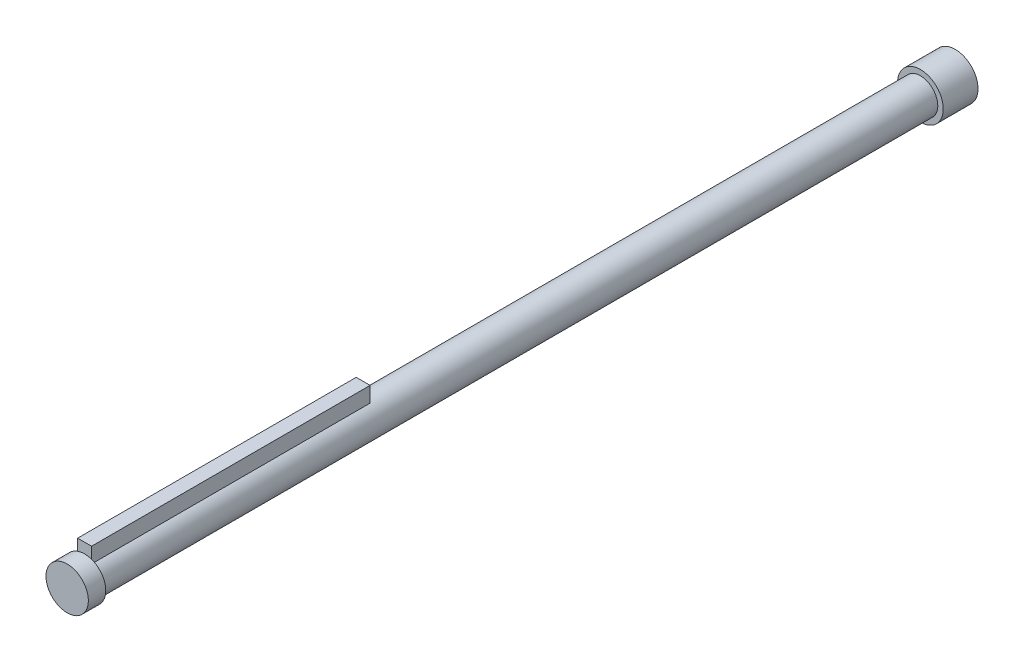
from build123d import *

# Parameters (mm, degrees)
SKETCH1_R           = 3.175
BOSS_EXTRUDE1_DEPTH = 152.4
SKETCH2_W           = 2.54
SKETCH2_H           = 5.08
BOSS_EXTRUDE4_DEPTH = 50.8
SKETCH3_R           = 4.162568093
BOSS_EXTRUDE5_DEPTH = 6.35
SKETCH4_R           = 3.861049132
BOSS_EXTRUDE6_DEPTH = 3.175


with BuildPart() as part:
    # Sketch1 → Boss-Extrude1 (new body)
    with BuildSketch(Plane.XY):
        with Locations(Location((0, 0, 0), (0, 0, 180))):
            Circle(SKETCH1_R)
    extrude(amount=BOSS_EXTRUDE1_DEPTH)

    # Sketch2 → Boss-Extrude4 (add)
    with BuildSketch(Plane.XY.offset(152.4)):
        with Locations((0, 3.175)):
            Rectangle(SKETCH2_W, SKETCH2_H)
    extrude(amount=-BOSS_EXTRUDE4_DEPTH)

    # Sketch3 → Boss-Extrude5 (add)
    with BuildSketch(Plane(origin=(0, 0, 0), x_dir=(-1, 0, 0), z_dir=(0, 0, -1))):
        Circle(SKETCH3_R)
    extrude(amount=BOSS_EXTRUDE5_DEPTH)

    # Sketch4 → Boss-Extrude6 (add)
    with BuildSketch(Plane.XY.offset(152.4)):
        with Locations(Location((0, 0, 0), (0, 0, 109.203609726))):
            Circle(SKETCH4_R)
    extrude(amount=BOSS_EXTRUDE6_DEPTH)


solid = part.part
